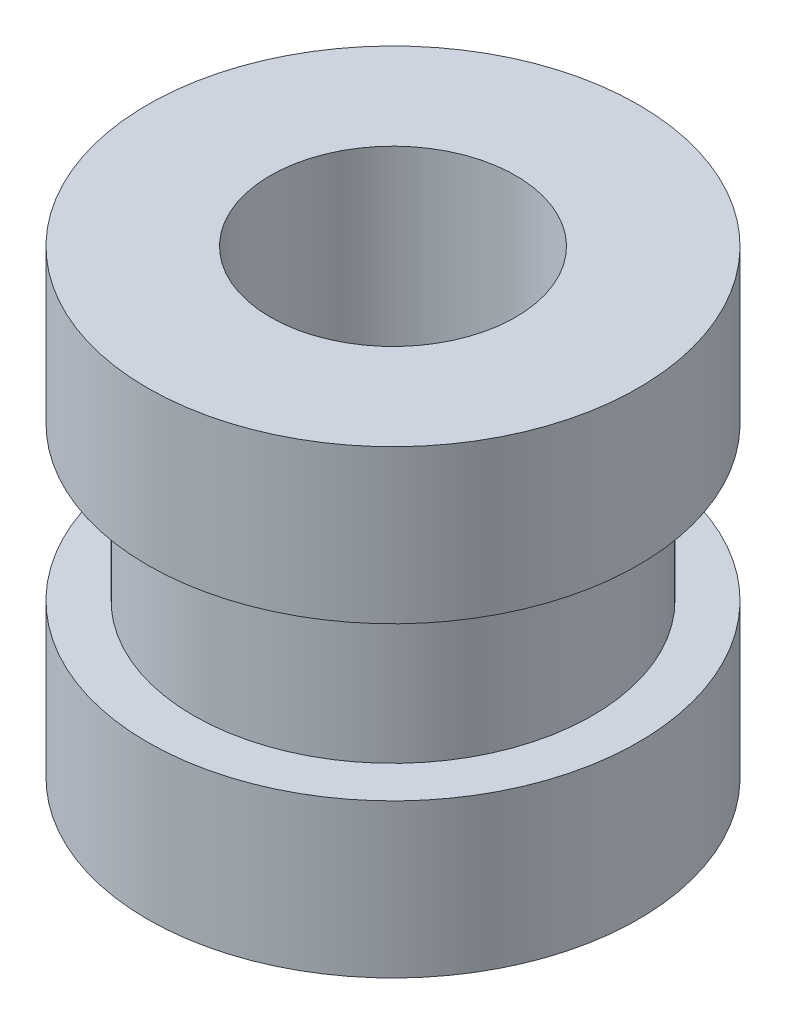
from build123d import *

# Parameters (mm, degrees)
SKETCH_1_R         = 1.6
EXTRUDE_1_DEPTH    = 1
SKETCH_2_R         = 1.3
EXTRUDE_2_DEPTH    = 1
SKETCH_3_R         = 1.6
EXTRUDE_3_DEPTH    = 1
HOLE_WIZARD_M2_1_D = 1.6


with BuildPart() as part:
    # 草图1 → 凸台-拉伸1 (new body)
    with BuildSketch(Plane(origin=(0, 0, 0), x_dir=(1, 0, 0), z_dir=(0, 1, 0))):
        with Locations(Location((0, 0, 0), (0, 0, 270))):
            Circle(SKETCH_1_R)
    extrude(amount=EXTRUDE_1_DEPTH)

    # 草图2 → 凸台-拉伸2 (add)
    with BuildSketch(Plane(origin=(0, 1, 0), x_dir=(1, 0, 0), z_dir=(0, 1, 0))):
        with Locations(Location((0, 0, 0), (0, 0, 270))):
            Circle(SKETCH_2_R)
    extrude(amount=EXTRUDE_2_DEPTH)

    # 草图3 → 凸台-拉伸3 (add)
    with BuildSketch(Plane(origin=(0, 2, 0), x_dir=(1, 0, 0), z_dir=(0, 1, 0))):
        with Locations(Location((0, 0, 0), (0, 0, 270))):
            Circle(SKETCH_3_R)
    extrude(amount=EXTRUDE_3_DEPTH)

    # M2 螺纹孔1 (through all)
    with Locations(Plane(origin=(0, 3, 0), x_dir=(1, 0, 0), z_dir=(0, 1, 0))):
        with Locations((0, 0)):
            Hole(HOLE_WIZARD_M2_1_D / 2)


solid = part.part
